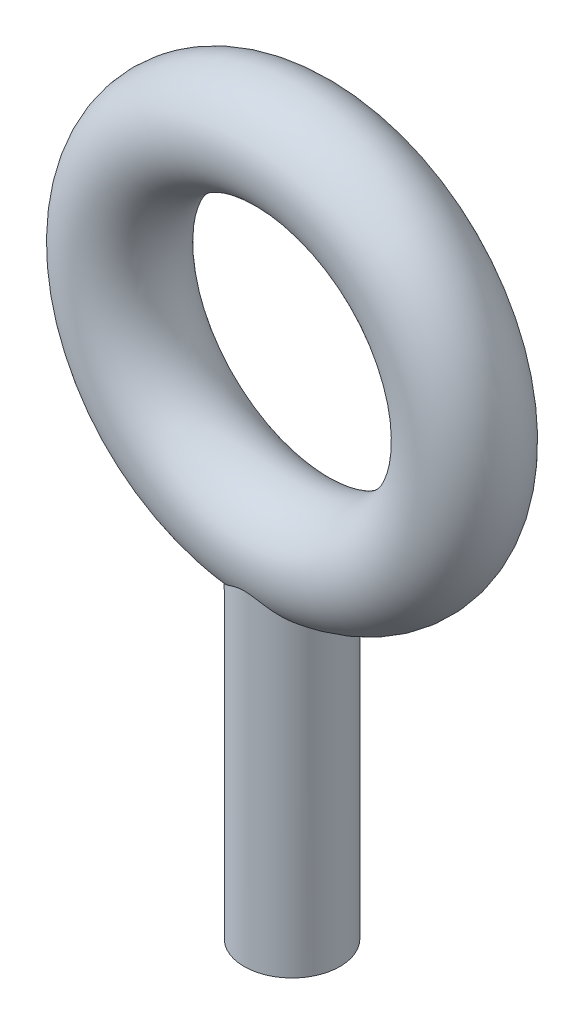
from build123d import *
from build123d.topology import SkipClean

# Parameters (mm, degrees)
SKETCH1_R           = 4.7625
SKETCH2_R           = 4.41325
BOSS_EXTRUDE1_DEPTH = 31.75


with BuildPart() as part:
    # Sketch1 → Revolve2 (revolve)
    with BuildSketch(Plane(origin=(0, 0, 0), x_dir=(0, 0, -1), z_dir=(1, 0, 0)), mode=Mode.PRIVATE) as revolve2_sk:
        with Locations((0, -15.875)):
            Circle(SKETCH1_R)
    revolve(revolve2_sk.sketch.rotate(Axis((0, 0, 0), (0, 0, -1)), 270), axis=Axis((0, 0, 0), (0, 0, -1)))

    # Sketch2 → Boss-Extrude1 (add)
    with SkipClean():  # the faces are left unmerged after this step: merging them gives an invalid solid
        with BuildSketch(Plane(origin=(0, -15.875, 0), x_dir=(1, 0, 0), z_dir=(0, 1, 0))):
            with Locations(Location((0, 0, 0), (0, 0, 270))):
                Circle(SKETCH2_R)
        extrude(amount=-BOSS_EXTRUDE1_DEPTH)


solid = part.part
